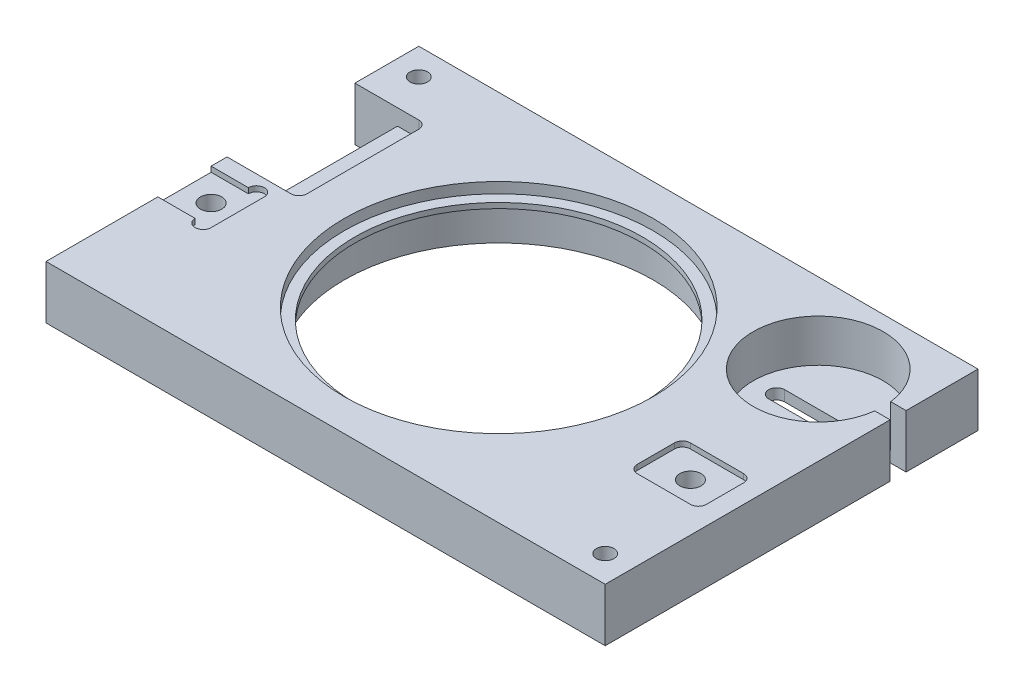
from build123d import *

# Parameters (mm, degrees)
ESQUISSE1_W               = 105
ESQUISSE1_H               = 70
ESQUISSE1_R               = 27
EXTRUSION1_DEPTH          = 10
ENL_V_START               = -8
ESQUISSE2_R               = 12.2
ENL_V_MAT_EXTRU_1_DEPTH   = 8
ESQUISSE3_R               = 2
ENL_V_MAT_EXTRU_2_DEPTH   = 66.954529791
ENL_V_MAT_EXTRU_3_DEPTH   = 1
ESQUISSE5_R               = 29
ENL_V_MAT_EXTRU_4_DEPTH   = 7
ENL_V_START_2             = -2
ESQUISSE6_R               = 29
ENL_V_MAT_EXTRU_6_DEPTH   = 2
ENL_V_MAT_EXTRU_7_REACH   = 67.955
ESQUISSE7_W               = 8
ESQUISSE7_H               = 24
ENL_V_MAT_EXTRU_8_DEPTH   = 3
TROU_TARAUD_M4X0_71_D     = 3.3
TROU_TARAUD_M4X0_71_DEPTH = 12.1
TROU_TARAUD_M4X0_71_TIP   = 0.991420021
TROU_TARAUD_M4X0_72_D     = 3.3


with BuildPart() as part:
    # Esquisse1 → Extrusion1 (new body)
    with BuildSketch(Plane(origin=(0, 0, 0), x_dir=(1, 0, 0), z_dir=(0, 1, 0))):
        with Locations((2.5, 0)):
            Rectangle(ESQUISSE1_W, ESQUISSE1_H)
        with Locations(Location((0, 0, 0), (0, 0, 270))):
            Circle(ESQUISSE1_R, mode=Mode.SUBTRACT)
    extrude(amount=EXTRUSION1_DEPTH)

    # Esquisse2 → Enlèv. mat.-Extru.1 (cut)
    with BuildSketch(Plane(origin=(0, 10, 0), x_dir=(-1, 0, 0), z_dir=(0, 1, 0)).offset(ENL_V_START)):
        with Locations(Location((-40, -20, 0), (0, 0, 90))):
            Circle(ESQUISSE2_R)
    extrude(amount=ENL_V_MAT_EXTRU_1_DEPTH, mode=Mode.SUBTRACT)

    # Esquisse3 → Enlèv. mat.-Extru.2 (cut, through all)
    with BuildSketch(Plane(origin=(0, 0, 0), x_dir=(1, 0, 0), z_dir=(0, 1, 0))):
        with Locations(Location((45, -9, 0), (0, 0, 270))):
            Circle(ESQUISSE3_R)
        with Locations(Location((-45, -9, 0), (0, 0, 270))):
            Circle(ESQUISSE3_R)
        with BuildLine():
            Line((32.2, 18.5), (55, 18.5))
            Line((55, 18.5), (55, 21.5))
            Line((55, 21.5), (32.2, 21.5))
            ThreePointArc((32.2, 21.5), (30.7, 20), (32.2, 18.5))
        make_face()
    extrude(amount=ENL_V_MAT_EXTRU_2_DEPTH, mode=Mode.SUBTRACT)

    # Esquisse4 → Enlèv. mat.-Extru.3 (cut)
    with BuildSketch(Plane(origin=(0, 10, 0), x_dir=(-1, 0, 0), z_dir=(0, 1, 0))):
        with BuildLine():
            Line((-50, 14), (-40, 14))
            ThreePointArc((-40, 14), (-38.939339828, 13.560660172), (-38.5, 12.5))
            Line((-38.5, 12.5), (-38.5, 5.5))
            ThreePointArc((-38.5, 5.5), (-38.939339828, 4.439339828), (-40, 4))
            Line((-40, 4), (-50, 4))
            ThreePointArc((-50, 4), (-51.060660172, 4.439339828), (-51.5, 5.5))
            Line((-51.5, 5.5), (-51.5, 12.5))
            ThreePointArc((-51.5, 12.5), (-51.060660172, 13.560660172), (-50, 14))
        make_face()
        with BuildLine():
            Line((50, 14), (43, 14))
            ThreePointArc((43, 14), (41.5, 15.5), (40, 14))
            Line((40, 14), (40, 4))
            ThreePointArc((40, 4), (41.5, 2.5), (43, 4))
            Line((43, 4), (50, 4))
            Line((50, 4), (50, 14))
        make_face()
    extrude(amount=-ENL_V_MAT_EXTRU_3_DEPTH, mode=Mode.SUBTRACT)

    # Esquisse5 → Enlèv. mat.-Extru.4 (cut)
    with BuildSketch(Plane(origin=(0, 0, 0), x_dir=(1, 0, 0), z_dir=(0, 1, 0))):
        Circle(ESQUISSE5_R)
    extrude(amount=ENL_V_MAT_EXTRU_4_DEPTH, mode=Mode.SUBTRACT)

    # Esquisse6 → Enlèv. mat.-Extru.6 (cut)
    with BuildSketch(Plane(origin=(0, 10, 0), x_dir=(-1, 0, 0), z_dir=(0, 1, 0)).offset(ENL_V_START_2)):
        with Locations(Location((0, 0, 0), (0, 0, 180))):
            Circle(ESQUISSE6_R)
    extrude(amount=ENL_V_MAT_EXTRU_6_DEPTH, mode=Mode.SUBTRACT)

    # Esquisse7 → Enlèv. mat.-Extru.7 (cut, up to next)
    with BuildSketch(Plane(origin=(0, 0, 0), x_dir=(1, 0, 0), z_dir=(0, 1, 0)), mode=Mode.PRIVATE) as enl_v_mat_extru_7_sk1:
        with Locations((-46, 11)):
            Rectangle(ESQUISSE7_W, ESQUISSE7_H)
    enl_v_mat_extru_7_tool1 = extrude(enl_v_mat_extru_7_sk1.sketch, amount=ENL_V_MAT_EXTRU_7_REACH, mode=Mode.PRIVATE) & part.part
    add(enl_v_mat_extru_7_tool1.solids().sort_by_distance((-46, 0, -11))[0], mode=Mode.SUBTRACT)

    # Esquisse8 → Enlèv. mat.-Extru.8 (cut)
    with BuildSketch(Plane(origin=(0, 10, 0), x_dir=(-1, 0, 0), z_dir=(0, 1, 0))):
        with BuildLine():
            Line((50, -23), (38, -23))
            ThreePointArc((38, -23), (36.939339828, -22.560660172), (36.5, -21.5))
            Line((36.5, -21.5), (36.5, -0.5))
            ThreePointArc((36.5, -0.5), (36.939339828, 0.560660172), (38, 1))
            Line((38, 1), (50, 1))
            Line((50, 1), (50, -23))
        make_face()
    extrude(amount=-ENL_V_MAT_EXTRU_8_DEPTH, mode=Mode.SUBTRACT)

    # Trou taraudé M4x0.71
    with Locations(Plane.ZY.offset(42)):
        with Locations((-11, 3.5)):
            Hole(TROU_TARAUD_M4X0_71_D / 2, depth=TROU_TARAUD_M4X0_71_DEPTH)
            with Locations((0, 0, -(TROU_TARAUD_M4X0_71_DEPTH + TROU_TARAUD_M4X0_71_TIP / 2))):  # 118° drill point
                Cone(0, TROU_TARAUD_M4X0_71_D / 2, TROU_TARAUD_M4X0_71_TIP, mode=Mode.SUBTRACT)

    # Trou taraudé M4x0.72 (through all)
    with Locations(Plane.XZ):
        with Locations((-45, -30), (50, 30)):
            Hole(TROU_TARAUD_M4X0_72_D / 2)


solid = part.part
